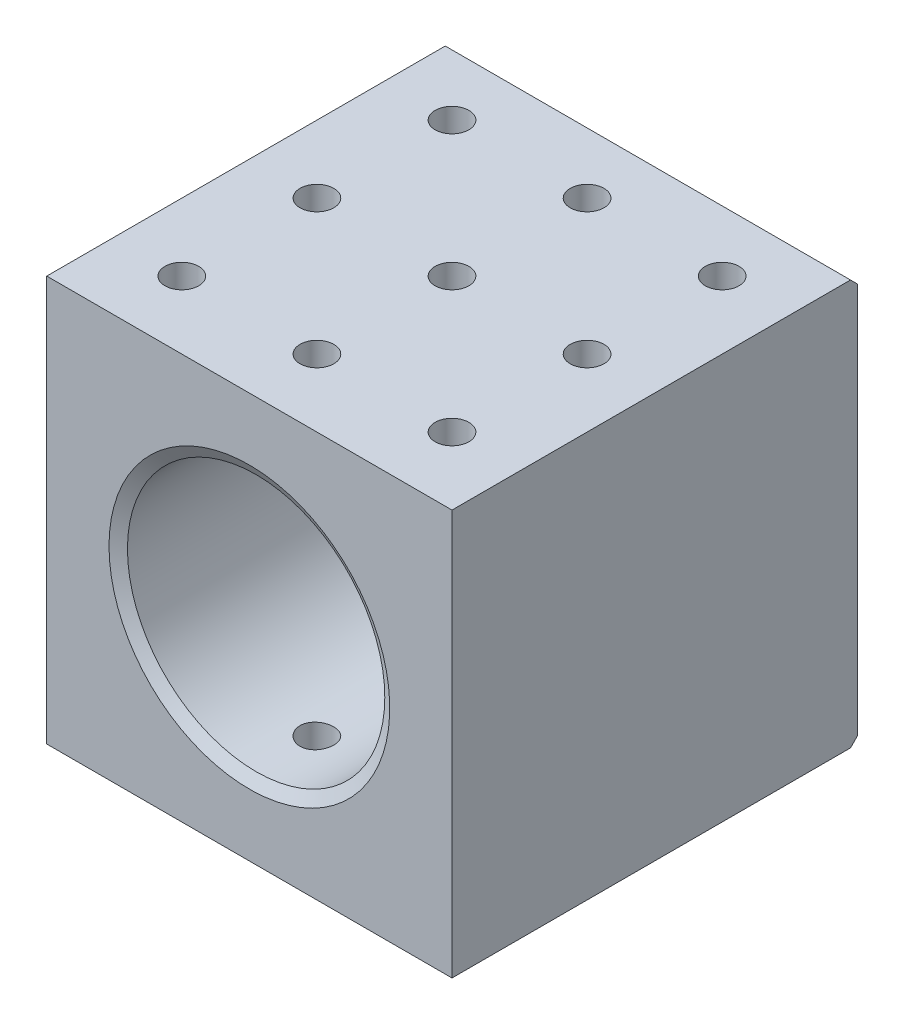
from build123d import *
from OCP.BRepFilletAPI import BRepFilletAPI_MakeChamfer

# Parameters (mm, degrees)
SKETCH1_W                      = 30
SKETCH1_H                      = 30
SKETCH1_R                      = 9.525
BOSS_EXTRUDE1_DEPTH            = 15
CHAMFER2_SIZE                  = 0.5
CHAMFER2_SIZE2                 = 0.866025404
CHAMFER3_SIZE                  = 0.5
M3X0_5_TAPPED_HOLE1_AT_2_COUNT = 2
M3X0_5_TAPPED_HOLE1_AT_2_PITCH = 20
M3X0_5_TAPPED_HOLE1_AT_3_COUNT = 2
M3X0_5_TAPPED_HOLE1_AT_3_PITCH = 10
M3X0_5_TAPPED_HOLE1_AT_4_COUNT = 2
M3X0_5_TAPPED_HOLE1_AT_4_PITCH = 10
M3X0_5_TAPPED_HOLE1_AT_5_COUNT = 2
M3X0_5_TAPPED_HOLE1_AT_5_PITCH = 10
M3X0_5_TAPPED_HOLE1_AT_6_COUNT = 2
M3X0_5_TAPPED_HOLE1_AT_6_PITCH = 22.360679775
M3X0_5_TAPPED_HOLE1_AT_7_COUNT = 2
M3X0_5_TAPPED_HOLE1_AT_7_PITCH = 22.360679775
M3X0_5_TAPPED_HOLE1_AT_8_COUNT = 2
M3X0_5_TAPPED_HOLE1_AT_8_PITCH = 14.142135624
M3X0_5_TAPPED_HOLE1_AT_9_COUNT = 2
M3X0_5_TAPPED_HOLE1_AT_9_PITCH = 14.142135624
CIRPATTERN1_COUNT              = 2


with BuildPart() as part:
    # Sketch1 → Boss-Extrude1 (new, symmetric)
    with BuildSketch(Plane.XY):
        Rectangle(SKETCH1_W, SKETCH1_H)
        Circle(SKETCH1_R, mode=Mode.SUBTRACT)
    extrude(amount=BOSS_EXTRUDE1_DEPTH, both=True)

    # Chamfer2: one chamfer whose edges measure the first distance from different faces: ONE call of the kernel's chamfer builder (chamfer() names one face for all edges)
    chamfer2_edges_1 = [part.edges().sort_by_distance(p)[0] for p in [
        (-9.525, 0, -15),
    ]]
    chamfer2_side_1 = [part.faces().sort_by_distance(p)[0] for p in [
        (0, -14.575735931, -15),
    ]]
    chamfer2_edges_2 = [part.edges().sort_by_distance(p)[0] for p in [
        (-9.525, 0, 15),
    ]]
    chamfer2_side_2 = [part.faces().sort_by_distance(p)[0] for p in [
        (-9.525, 0, 0),
    ]]
    chamfer2 = BRepFilletAPI_MakeChamfer(part.part.solid().wrapped)
    for e in chamfer2_edges_1:
        chamfer2.Add(CHAMFER2_SIZE, CHAMFER2_SIZE2, e.wrapped, chamfer2_side_1[0].wrapped)  # the first distance lies on this face
    for e in chamfer2_edges_2:
        chamfer2.Add(CHAMFER2_SIZE, CHAMFER2_SIZE2, e.wrapped, chamfer2_side_2[0].wrapped)  # the first distance lies on this face
    add(Compound.cast(chamfer2.Shape()), mode=Mode.REPLACE)

    # Chamfer3
    chamfer3_edges = [part.edges().sort_by_distance(p)[0] for p in [
        (0, 15, -15),
        (0, -15, -15),
    ]]
    chamfer(chamfer3_edges, length=CHAMFER3_SIZE)

    # Sketch8 → M3x0.5 Tapped Hole1 (revolve, cut)
    with BuildSketch(Plane(origin=(-10, 15, 0), x_dir=(0, 0, 1), z_dir=(1, 0, 0))):
        Polygon((0, 0), (0, 6.751075774), (1.25, 6), (1.25, 0), align=None)
    m3x0_5_tapped_hole1 = revolve(axis=Axis((-10, 21.35, 0), (0, -1, 0)), mode=Mode.SUBTRACT)

    # M3x0.5 Tapped Hole1 at 2: M3x0.5 Tapped Hole1 ×2
    with Locations(*[(i * M3X0_5_TAPPED_HOLE1_AT_2_PITCH, 0, 0) for i in range(1, M3X0_5_TAPPED_HOLE1_AT_2_COUNT)]):
        add(m3x0_5_tapped_hole1, mode=Mode.SUBTRACT)

    # M3x0.5 Tapped Hole1 at 3: M3x0.5 Tapped Hole1 ×2
    with Locations(*[(i * M3X0_5_TAPPED_HOLE1_AT_3_PITCH, 0, 0) for i in range(1, M3X0_5_TAPPED_HOLE1_AT_3_COUNT)]):
        add(m3x0_5_tapped_hole1, mode=Mode.SUBTRACT)

    # M3x0.5 Tapped Hole1 at 4: M3x0.5 Tapped Hole1 ×2
    with Locations(*[(0, 0, -i * M3X0_5_TAPPED_HOLE1_AT_4_PITCH) for i in range(1, M3X0_5_TAPPED_HOLE1_AT_4_COUNT)]):
        add(m3x0_5_tapped_hole1, mode=Mode.SUBTRACT)

    # M3x0.5 Tapped Hole1 at 5: M3x0.5 Tapped Hole1 ×2
    with Locations(*[(0, 0, i * M3X0_5_TAPPED_HOLE1_AT_5_PITCH) for i in range(1, M3X0_5_TAPPED_HOLE1_AT_5_COUNT)]):
        add(m3x0_5_tapped_hole1, mode=Mode.SUBTRACT)

    # M3x0.5 Tapped Hole1 at 6: M3x0.5 Tapped Hole1 ×2
    with Locations(*[Vector(0.894427190999916, 0, -0.44721359549995787) * (i * M3X0_5_TAPPED_HOLE1_AT_6_PITCH) for i in range(1, M3X0_5_TAPPED_HOLE1_AT_6_COUNT)]):
        add(m3x0_5_tapped_hole1, mode=Mode.SUBTRACT)

    # M3x0.5 Tapped Hole1 at 7: M3x0.5 Tapped Hole1 ×2
    with Locations(*[Vector(0.8944271909999159, 0, 0.447213595499958) * (i * M3X0_5_TAPPED_HOLE1_AT_7_PITCH) for i in range(1, M3X0_5_TAPPED_HOLE1_AT_7_COUNT)]):
        add(m3x0_5_tapped_hole1, mode=Mode.SUBTRACT)

    # M3x0.5 Tapped Hole1 at 8: M3x0.5 Tapped Hole1 ×2
    with Locations(*[Vector(0.7071067811865476, 0, -0.7071067811865475) * (i * M3X0_5_TAPPED_HOLE1_AT_8_PITCH) for i in range(1, M3X0_5_TAPPED_HOLE1_AT_8_COUNT)]):
        add(m3x0_5_tapped_hole1, mode=Mode.SUBTRACT)

    # M3x0.5 Tapped Hole1 at 9: M3x0.5 Tapped Hole1 ×2
    with Locations(*[Vector(0.7071067811865475, 0, 0.7071067811865476) * (i * M3X0_5_TAPPED_HOLE1_AT_9_PITCH) for i in range(1, M3X0_5_TAPPED_HOLE1_AT_9_COUNT)]):
        add(m3x0_5_tapped_hole1, mode=Mode.SUBTRACT)

    # CirPattern1: M3x0.5 Tapped Hole1 ×2 about axis
    cirpattern1_axis = Axis((0, 0, 15), (0, 0, -1))
    for i in range(1, CIRPATTERN1_COUNT):
        add(m3x0_5_tapped_hole1.rotate(cirpattern1_axis, i * 360 / CIRPATTERN1_COUNT), mode=Mode.SUBTRACT)

    # CirPattern1 copy 1 sketch → CirPattern1 copy 1 (revolve, cut)
    with BuildSketch(Plane(origin=(-10, -15, 0), x_dir=(0, 0, 1), z_dir=(-1, 0, 0))):
        Polygon((0, 0), (0, 6.751075774), (1.25, 6), (1.25, 0), align=None)
    revolve(axis=Axis((-10, -21.35, 0), (0, 1, 0)), mode=Mode.SUBTRACT)

    # CirPattern1 copy 2 sketch → CirPattern1 copy 2 (revolve, cut)
    with BuildSketch(Plane(origin=(0, -15, 0), x_dir=(0, 0, 1), z_dir=(-1, 0, 0))):
        Polygon((0, 0), (0, 6.751075774), (1.25, 6), (1.25, 0), align=None)
    revolve(axis=Axis((0, -21.35, 0), (0, 1, 0)), mode=Mode.SUBTRACT)

    # CirPattern1 copy 3 sketch → CirPattern1 copy 3 (revolve, cut)
    with BuildSketch(Plane(origin=(10, -15, -10), x_dir=(0, 0, 1), z_dir=(-1, 0, 0))):
        Polygon((0, 0), (0, 6.751075774), (1.25, 6), (1.25, 0), align=None)
    revolve(axis=Axis((10, -21.35, -10), (0, 1, 0)), mode=Mode.SUBTRACT)

    # CirPattern1 copy 4 sketch → CirPattern1 copy 4 (revolve, cut)
    with BuildSketch(Plane(origin=(10, -15, 10), x_dir=(0, 0, 1), z_dir=(-1, 0, 0))):
        Polygon((0, 0), (0, 6.751075774), (1.25, 6), (1.25, 0), align=None)
    revolve(axis=Axis((10, -21.35, 10), (0, 1, 0)), mode=Mode.SUBTRACT)

    # CirPattern1 copy 5 sketch → CirPattern1 copy 5 (revolve, cut)
    with BuildSketch(Plane(origin=(-10, -15, -10), x_dir=(0, 0, 1), z_dir=(-1, 0, 0))):
        Polygon((0, 0), (0, 6.751075774), (1.25, 6), (1.25, 0), align=None)
    revolve(axis=Axis((-10, -21.35, -10), (0, 1, 0)), mode=Mode.SUBTRACT)

    # CirPattern1 copy 6 sketch → CirPattern1 copy 6 (revolve, cut)
    with BuildSketch(Plane(origin=(-10, -15, 10), x_dir=(0, 0, 1), z_dir=(-1, 0, 0))):
        Polygon((0, 0), (0, 6.751075774), (1.25, 6), (1.25, 0), align=None)
    revolve(axis=Axis((-10, -21.35, 10), (0, 1, 0)), mode=Mode.SUBTRACT)

    # CirPattern1 copy 7 sketch → CirPattern1 copy 7 (revolve, cut)
    with BuildSketch(Plane(origin=(0, -15, -10), x_dir=(0, 0, 1), z_dir=(-1, 0, 0))):
        Polygon((0, 0), (0, 6.751075774), (1.25, 6), (1.25, 0), align=None)
    revolve(axis=Axis((0, -21.35, -10), (0, 1, 0)), mode=Mode.SUBTRACT)

    # CirPattern1 copy 8 sketch → CirPattern1 copy 8 (revolve, cut)
    with BuildSketch(Plane(origin=(0, -15, 10), x_dir=(0, 0, 1), z_dir=(-1, 0, 0))):
        Polygon((0, 0), (0, 6.751075774), (1.25, 6), (1.25, 0), align=None)
    revolve(axis=Axis((0, -21.35, 10), (0, 1, 0)), mode=Mode.SUBTRACT)


solid = part.part
